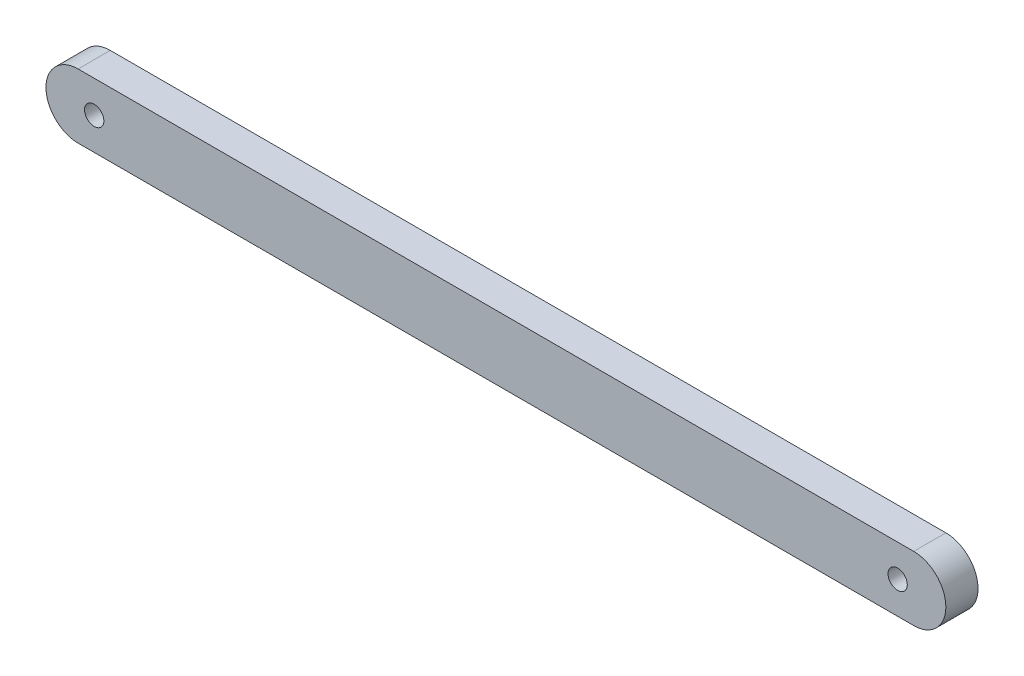
from build123d import *

# Parameters (mm, degrees)
ESQUISSE1_R        = 3
BOSS_EXTRU_1_DEPTH = 10


with BuildPart() as part:
    # Esquisse1 → Boss.-Extru.1 (new body)
    with BuildSketch(Plane.XY):
        with BuildLine():
            Line((-122.628083491, -8.225806452), (137.371916509, -8.225806452))
            ThreePointArc((137.371916509, -8.225806452), (147.371916509, -18.225806452), (137.371916509, -28.225806452))
            Line((137.371916509, -28.225806452), (-122.628083491, -28.225806452))
            ThreePointArc((-122.628083491, -28.225806452), (-132.628083491, -18.225806452), (-122.628083491, -8.225806452))
        make_face()
        with Locations((-117.628083491, -18.225806452)):
            Circle(ESQUISSE1_R, mode=Mode.SUBTRACT)
        with Locations((132.371916509, -18.225806452)):
            Circle(ESQUISSE1_R, mode=Mode.SUBTRACT)
    extrude(amount=BOSS_EXTRU_1_DEPTH)


solid = part.part
